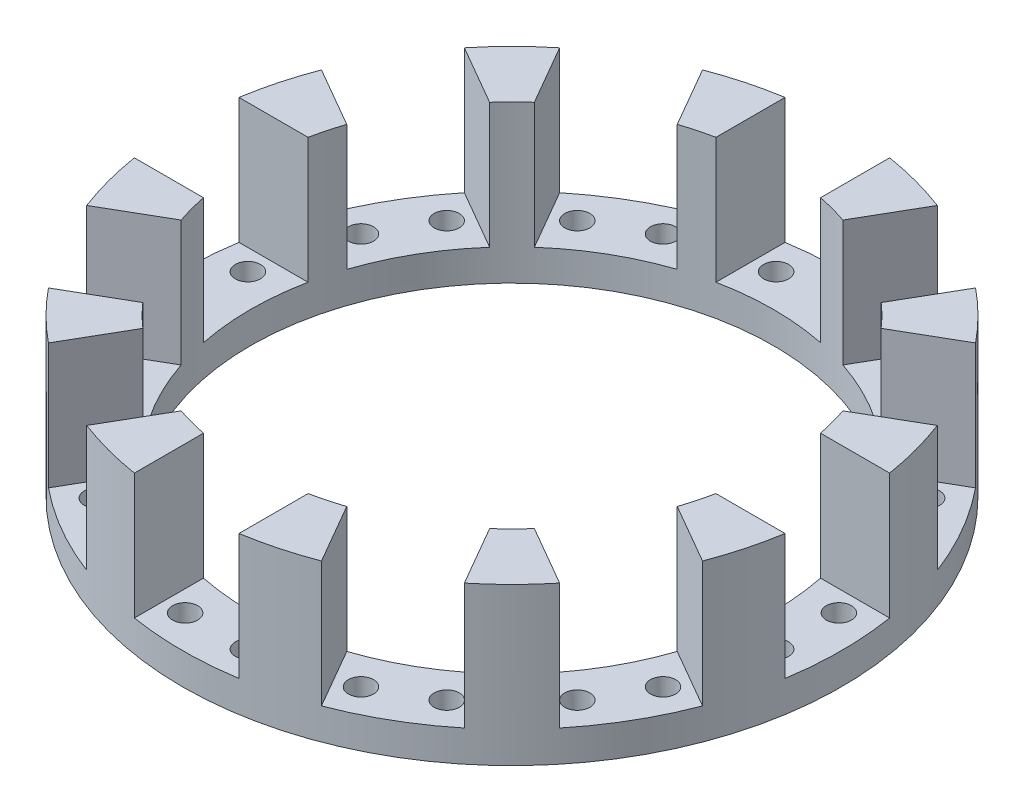
from build123d import *

# Parameters (mm, degrees)
SKETCH1_R           = 157.5
SKETCH1_R_2         = 125
BOSS_EXTRUDE1_DEPTH = 37.5
SKETCH2_W           = 50
SKETCH2_H           = 60
CUT_EXTRUDE1_DEPTH  = 226.873305196
CIRPATTERN1_COUNT   = 12
SKETCH3_R           = 6
CUT_EXTRUDE2_DEPTH  = 236.02659424
CIRPATTERN2_COUNT   = 12


with BuildPart() as part:
    # Sketch1 → Boss-Extrude1 (new, symmetric)
    with BuildSketch(Plane(origin=(0, 0, 0), x_dir=(1, 0, 0), z_dir=(0, 1, 0))):
        with Locations(Location((0, 0, 0), (0, 0, 270))):
            Circle(SKETCH1_R)
        with Locations(Location((0, 0, 0), (0, 0, 270))):
            Circle(SKETCH1_R_2, mode=Mode.SUBTRACT)
    extrude(amount=BOSS_EXTRUDE1_DEPTH, both=True)

    # Sketch2 → Cut-Extrude1 (cut, symmetric)
    with BuildSketch(Plane.XY):
        with Locations((0, 7.5)):
            Rectangle(SKETCH2_W, SKETCH2_H)
    cut_extrude1 = extrude(amount=CUT_EXTRUDE1_DEPTH, both=True, mode=Mode.SUBTRACT)

    # CirPattern1: Cut-Extrude1 ×12 about axis
    cirpattern1_axis = Axis((0, 0, 0), (0, 1, 0))
    for i in range(1, CIRPATTERN1_COUNT):
        add(cut_extrude1.rotate(cirpattern1_axis, i * 360 / CIRPATTERN1_COUNT), mode=Mode.SUBTRACT)

    # Sketch3 → Cut-Extrude2 (cut, through all)
    with BuildSketch(Plane.XZ.offset(37.5)):
        with Locations(Location((-15, 141.25, 0), (0, 0, 270))):
            Circle(SKETCH3_R)
        with Locations(Location((15, 141.25, 0), (0, 0, 270))):
            Circle(SKETCH3_R)
    cut_extrude2 = extrude(amount=-CUT_EXTRUDE2_DEPTH, mode=Mode.SUBTRACT)

    # CirPattern2: Cut-Extrude2 ×12 about axis
    cirpattern2_axis = Axis((0, 0, 0), (0, 1, 0))
    for i in range(1, CIRPATTERN2_COUNT):
        add(cut_extrude2.rotate(cirpattern2_axis, i * 360 / CIRPATTERN2_COUNT), mode=Mode.SUBTRACT)


solid = part.part
